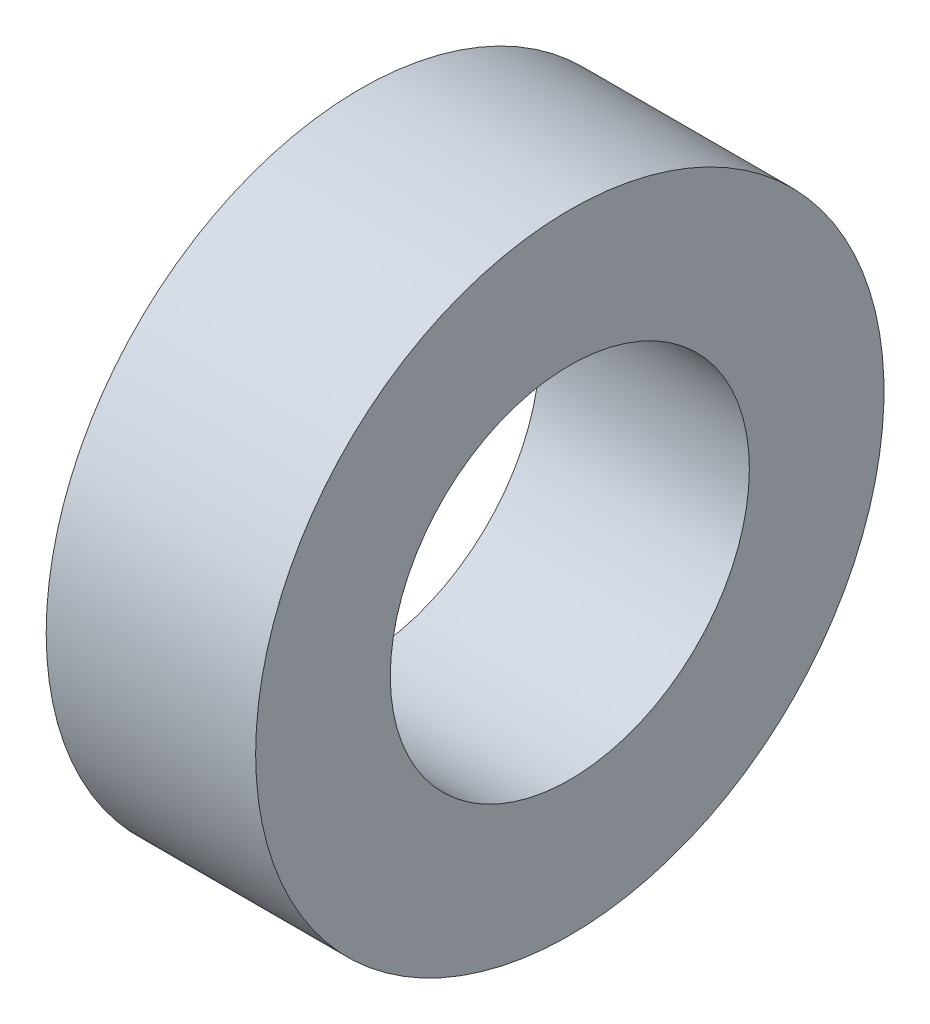
from build123d import *

# Parameters (mm, degrees)
SKETCH_2_R = 0.75
FILLET_1_R = 0.3


with BuildPart() as part:
    # 草图2 → 旋转1 (revolve)
    with BuildSketch(Plane.XY, mode=Mode.PRIVATE) as revolve_1_sk:
        with BuildLine():
            ThreePointArc((2.25, 7.2), (1.5, 7.95), (0.75, 7.2))
            Line((0.75, 7.2), (2.25, 7.2))
        make_face()
        with BuildLine():
            Line((2.25, 7.2), (0.75, 7.2))
            ThreePointArc((0.75, 7.2), (1.5, 6.45), (2.25, 7.2))
        make_face()
        with Locations((1.5, 7.2)):
            Circle(SKETCH_2_R)
        Polygon((5.5, 7.2), (0, 7.2), (0, 6), (7, 6), (7, 10.5), (0, 10.5), (0, 9.3), (5.5, 9.3), align=None)
    revolve(revolve_1_sk.sketch.rotate(Axis((-18.653285905, 0, 0), (1, 0, 0)), 90), axis=Axis((-18.653285905, 0, 0), (1, 0, 0)))

    # 圆角1
    fillet_1_edges = [part.edges().sort_by_distance(p)[0] for p in [
        (5.5, 0, -7.2),
        (5.5, 0, -9.3),
    ]]
    fillet(fillet_1_edges, radius=FILLET_1_R)


solid = part.part
